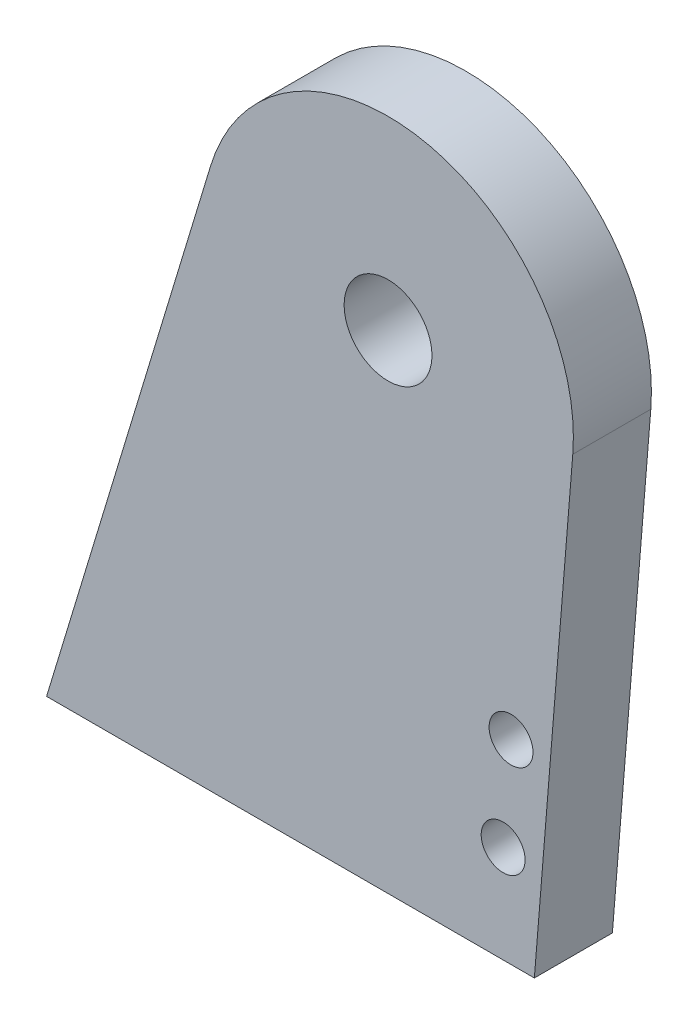
from build123d import *

# Parameters (mm, degrees)
EXTRUDE_1_DEPTH              = 8
HOLE_WIZARD_M4_1_D           = 4.5
HOLE_WIZARD_M3_1_D           = 2.5
HOLE_WIZARD_M3_1_DEPTH       = 8.5
HOLE_WIZARD_M3_1_CSINK_D     = 3.05
HOLE_WIZARD_M3_1_CSINK_ANGLE = 90
HOLE_WIZARD_M3_1_TIP         = 0.751075774
HOLE_WIZARD_M8_1_D           = 9


with BuildPart() as part:
    # 스케치1 → 보스-돌출1 (new body)
    with BuildSketch(Plane.XY):
        with BuildLine():
            Line((16.816107383, 55.508724832), (0, 0))
            Line((0, 0), (50, 0))
            Line((50, 0), (53.937590447, 48.461277134))
            ThreePointArc((53.937590447, 48.461277134), (31.456182162, 31.333416083), (16.816107383, 55.508724832))
        make_face()
        with BuildLine():
            ThreePointArc((54, 50), (37.784424561, 68.794865785), (16.816107383, 55.508724832))
            ThreePointArc((16.816107383, 55.508724832), (31.456182162, 31.333416083), (53.937590447, 48.461277134))
            ThreePointArc((53.937590447, 48.461277134), (53.9843912, 49.230006005), (54, 50))
        make_face()
    extrude(amount=EXTRUDE_1_DEPTH)

    # M4 여유 구멍1 (through all)
    with Locations(Plane.XY.offset(8)):
        with Locations((46.799340892, 10), (47.609195032, 19.967152867)):
            Hole(HOLE_WIZARD_M4_1_D / 2)

    # M3 나사 구멍1
    with Locations(Plane(origin=(0, 0, 0), x_dir=(-1, 0, 0), z_dir=(0, -1, 0))):
        with Locations((-10, -4), (-40, -4)):
            CounterSinkHole(HOLE_WIZARD_M3_1_D / 2, HOLE_WIZARD_M3_1_CSINK_D / 2, depth=HOLE_WIZARD_M3_1_DEPTH, counter_sink_angle=HOLE_WIZARD_M3_1_CSINK_ANGLE)
            with Locations((0, 0, -(HOLE_WIZARD_M3_1_DEPTH + HOLE_WIZARD_M3_1_TIP / 2))):  # 118° drill point
                Cone(0, HOLE_WIZARD_M3_1_D / 2, HOLE_WIZARD_M3_1_TIP, mode=Mode.SUBTRACT)

    # M8 여유 구멍1 (through all)
    with Locations(Plane(origin=(0, 0, 0), x_dir=(-1, 0, 0), z_dir=(0, 0, -1))):
        with Locations((-35, 50)):
            Hole(HOLE_WIZARD_M8_1_D / 2)


solid = part.part
